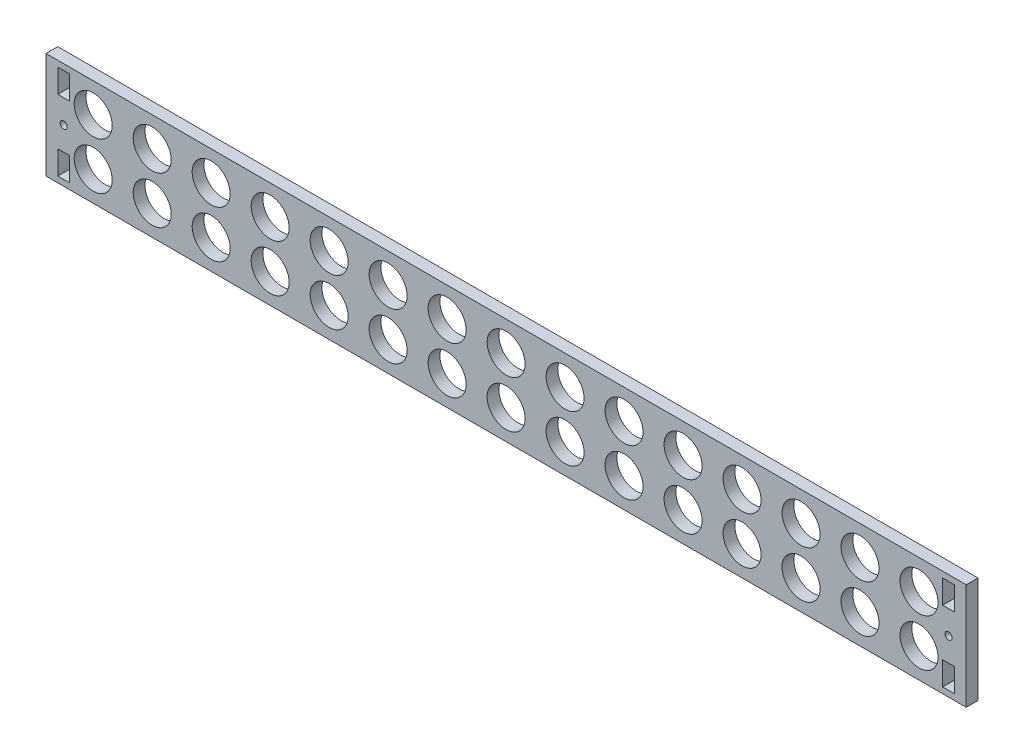
from build123d import *

# Parameters (mm, degrees)
SKETCH1_W           = 390
SKETCH1_H           = 45
SKETCH1_R           = 8.05
SKETCH1_R_2         = 1.5
SKETCH1_W_2         = 5
SKETCH1_H_2         = 10
BOSS_EXTRUDE1_DEPTH = 5


with BuildPart() as part:
    # Sketch1 → Boss-Extrude1 (new body)
    with BuildSketch(Plane.XY):
        with Locations((109.186746988, 0)):
            Rectangle(SKETCH1_W, SKETCH1_H)
        with Locations((-65.813253012, 10)):
            Circle(SKETCH1_R, mode=Mode.SUBTRACT)
        with Locations((-40.813253012, 10)):
            Circle(SKETCH1_R, mode=Mode.SUBTRACT)
        with Locations((-15.813253012, 10)):
            Circle(SKETCH1_R, mode=Mode.SUBTRACT)
        with Locations((9.186746988, 10)):
            Circle(SKETCH1_R, mode=Mode.SUBTRACT)
        with Locations((34.186746988, 10)):
            Circle(SKETCH1_R, mode=Mode.SUBTRACT)
        with Locations((59.186746988, 10)):
            Circle(SKETCH1_R, mode=Mode.SUBTRACT)
        with Locations((84.186746988, 10)):
            Circle(SKETCH1_R, mode=Mode.SUBTRACT)
        with Locations((109.186746988, 10)):
            Circle(SKETCH1_R, mode=Mode.SUBTRACT)
        with Locations((134.186746988, 10)):
            Circle(SKETCH1_R, mode=Mode.SUBTRACT)
        with Locations((159.186746988, 10)):
            Circle(SKETCH1_R, mode=Mode.SUBTRACT)
        with Locations((184.186746988, 10)):
            Circle(SKETCH1_R, mode=Mode.SUBTRACT)
        with Locations((209.186746988, 10)):
            Circle(SKETCH1_R, mode=Mode.SUBTRACT)
        with Locations((234.186746988, 10)):
            Circle(SKETCH1_R, mode=Mode.SUBTRACT)
        with Locations((259.186746988, 10)):
            Circle(SKETCH1_R, mode=Mode.SUBTRACT)
        with Locations((284.186746988, 10)):
            Circle(SKETCH1_R, mode=Mode.SUBTRACT)
        with Locations(Location((284.186746988, -10, 0), (0, 0, 180))):
            Circle(SKETCH1_R, mode=Mode.SUBTRACT)
        with Locations(Location((259.186746988, -10, 0), (0, 0, 180))):
            Circle(SKETCH1_R, mode=Mode.SUBTRACT)
        with Locations(Location((234.186746988, -10, 0), (0, 0, 180))):
            Circle(SKETCH1_R, mode=Mode.SUBTRACT)
        with Locations(Location((209.186746988, -10, 0), (0, 0, 180))):
            Circle(SKETCH1_R, mode=Mode.SUBTRACT)
        with Locations(Location((184.186746988, -10, 0), (0, 0, 180))):
            Circle(SKETCH1_R, mode=Mode.SUBTRACT)
        with Locations(Location((159.186746988, -10, 0), (0, 0, 180))):
            Circle(SKETCH1_R, mode=Mode.SUBTRACT)
        with Locations(Location((134.186746988, -10, 0), (0, 0, 180))):
            Circle(SKETCH1_R, mode=Mode.SUBTRACT)
        with Locations(Location((109.186746988, -10, 0), (0, 0, 180))):
            Circle(SKETCH1_R, mode=Mode.SUBTRACT)
        with Locations(Location((84.186746988, -10, 0), (0, 0, 180))):
            Circle(SKETCH1_R, mode=Mode.SUBTRACT)
        with Locations(Location((59.186746988, -10, 0), (0, 0, 180))):
            Circle(SKETCH1_R, mode=Mode.SUBTRACT)
        with Locations(Location((34.186746988, -10, 0), (0, 0, 180))):
            Circle(SKETCH1_R, mode=Mode.SUBTRACT)
        with Locations(Location((9.186746988, -10, 0), (0, 0, 180))):
            Circle(SKETCH1_R, mode=Mode.SUBTRACT)
        with Locations(Location((-15.813253012, -10, 0), (0, 0, 180))):
            Circle(SKETCH1_R, mode=Mode.SUBTRACT)
        with Locations(Location((-40.813253012, -10, 0), (0, 0, 180))):
            Circle(SKETCH1_R, mode=Mode.SUBTRACT)
        with Locations(Location((-65.813253012, -10, 0), (0, 0, 180))):
            Circle(SKETCH1_R, mode=Mode.SUBTRACT)
        with Locations((-78.313253012, 0)):
            Circle(SKETCH1_R_2, mode=Mode.SUBTRACT)
        with Locations(Location((296.686746988, 0, 0), (0, 0, 180))):
            Circle(SKETCH1_R_2, mode=Mode.SUBTRACT)
        with Locations((-78.313253012, -15)):
            Rectangle(SKETCH1_W_2, SKETCH1_H_2, mode=Mode.SUBTRACT)
        with Locations((-78.313253012, 15)):
            Rectangle(SKETCH1_W_2, SKETCH1_H_2, mode=Mode.SUBTRACT)
        with Locations((296.686746988, -15)):
            Rectangle(SKETCH1_W_2, SKETCH1_H_2, mode=Mode.SUBTRACT)
        with Locations((296.686746988, 15)):
            Rectangle(SKETCH1_W_2, SKETCH1_H_2, mode=Mode.SUBTRACT)
    extrude(amount=BOSS_EXTRUDE1_DEPTH)


solid = part.part
